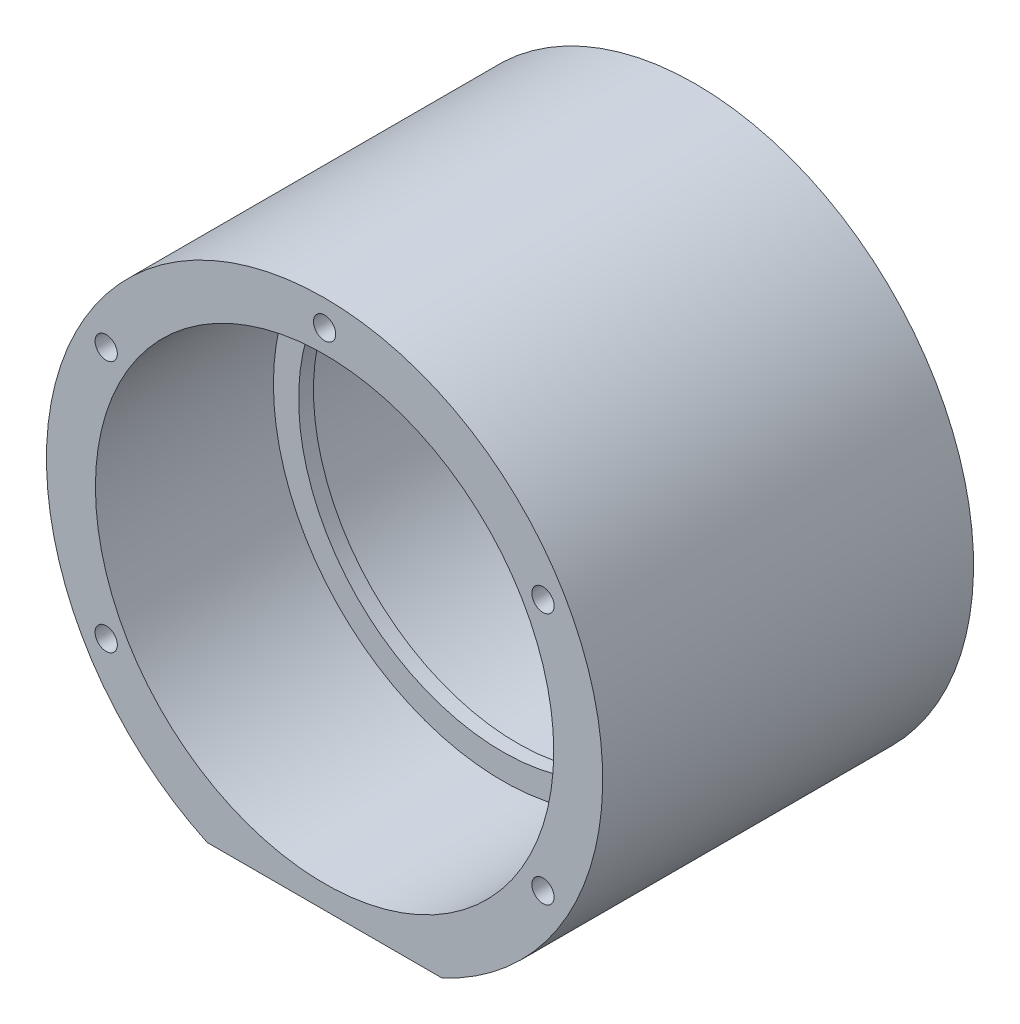
from build123d import *

# Parameters (mm, degrees)
SKETCH1_R                = 30.9
SKETCH1_R_2              = 1.5
BOSS_EXTRUDE1_DEPTH      = 50
BOSS_EXTRUDE2_DEPTH      = 1
BOSS_EXTRUDE2_DEPTH_BACK = 1
SKETCH2_R                = 30.9
SKETCH2_R_2              = 27.5


with BuildPart() as part:
    # Sketch1 → Boss-Extrude1 (new body)
    with BuildSketch(Plane.XY):
        with BuildLine():
            Line((-15.81929202, -34), (15.81929202, -34))
            ThreePointArc((15.81929202, -34), (0, 37.5), (-15.81929202, -34))
        make_face()
        Circle(SKETCH1_R, mode=Mode.SUBTRACT)
        with Locations((0, 34)):
            Circle(SKETCH1_R_2, mode=Mode.SUBTRACT)
        with Locations((29.444863729, 17)):
            Circle(SKETCH1_R_2, mode=Mode.SUBTRACT)
        with Locations((29.444863729, -17)):
            Circle(SKETCH1_R_2, mode=Mode.SUBTRACT)
        with Locations((-29.444863729, -17)):
            Circle(SKETCH1_R_2, mode=Mode.SUBTRACT)
        with Locations((-29.444863729, 17)):
            Circle(SKETCH1_R_2, mode=Mode.SUBTRACT)
    extrude(amount=BOSS_EXTRUDE1_DEPTH)

    # Sketch2 → Boss-Extrude2 (add, two sides: drawn at the far end of the back side and taken through both)
    with BuildSketch(Plane.XY.offset(25).offset(-BOSS_EXTRUDE2_DEPTH_BACK)):
        Circle(SKETCH2_R)
        Circle(SKETCH2_R_2, mode=Mode.SUBTRACT)
    extrude(amount=BOSS_EXTRUDE2_DEPTH + BOSS_EXTRUDE2_DEPTH_BACK)


solid = part.part
